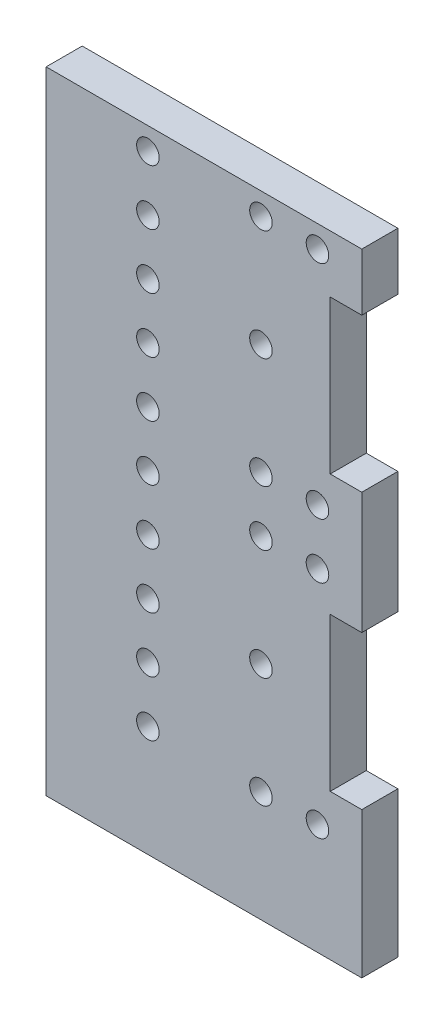
from build123d import *

# Parameters (mm, degrees)
BOSS_EXTRUDE1_DEPTH = 1.6
SKETCH2_R           = 0.5
CUT_EXTRUDE1_DEPTH  = 16.734039532


with BuildPart() as part:
    # Sketch1 → Boss-Extrude1 (new body)
    with BuildSketch(Plane.XY):
        Polygon((7, 11.46), (5.6, 11.46), (5.6, 4.66), (7, 4.66), (7, -0.732), (5.6, -0.732), (5.6, -7.532), (7, -7.532), (7, -14), (-7, -14), (-7, 14), (7, 14), align=None)
    extrude(amount=BOSS_EXTRUDE1_DEPTH)

    # Sketch2 → Cut-Extrude1 (cut, through all)
    with BuildSketch(Plane.XY.offset(1.6)):
        with Locations((-2.486935959, 13.013337482)):
            Circle(SKETCH2_R)
        with Locations((-2.486935959, 10.558296047)):
            Circle(SKETCH2_R)
        with Locations((-2.486935959, 8.103254612)):
            Circle(SKETCH2_R)
        with Locations((-2.486935959, 5.648213177)):
            Circle(SKETCH2_R)
        with Locations((-2.486935959, 3.193171742)):
            Circle(SKETCH2_R)
        with Locations((-2.486935959, 0.738130307)):
            Circle(SKETCH2_R)
        with Locations((-2.486935959, -1.716911128)):
            Circle(SKETCH2_R)
        with Locations((-2.486935959, -6.626993998)):
            Circle(SKETCH2_R)
        with Locations((-2.486935959, -9.082035433)):
            Circle(SKETCH2_R)
        with Locations((2.527644678, -4.171952563)):
            Circle(SKETCH2_R)
        with Locations((2.527644678, 8.103254612)):
            Circle(SKETCH2_R)
        with Locations((-2.486935959, -4.171952563)):
            Circle(SKETCH2_R)
        with Locations((2.527644678, 0.738130307)):
            Circle(SKETCH2_R)
        with Locations((2.527644678, 3.193171742)):
            Circle(SKETCH2_R)
        with Locations((5.034934997, 3.193171742)):
            Circle(SKETCH2_R)
        with Locations((5.034934997, 0.738130307)):
            Circle(SKETCH2_R)
        with Locations((2.527644678, 13.013337482)):
            Circle(SKETCH2_R)
        with Locations((5.034934997, 13.013337482)):
            Circle(SKETCH2_R)
        with Locations((5.034934997, -9.082035433)):
            Circle(SKETCH2_R)
        with Locations((2.527644678, -9.082035433)):
            Circle(SKETCH2_R)
    extrude(amount=-CUT_EXTRUDE1_DEPTH, mode=Mode.SUBTRACT)


solid = part.part
